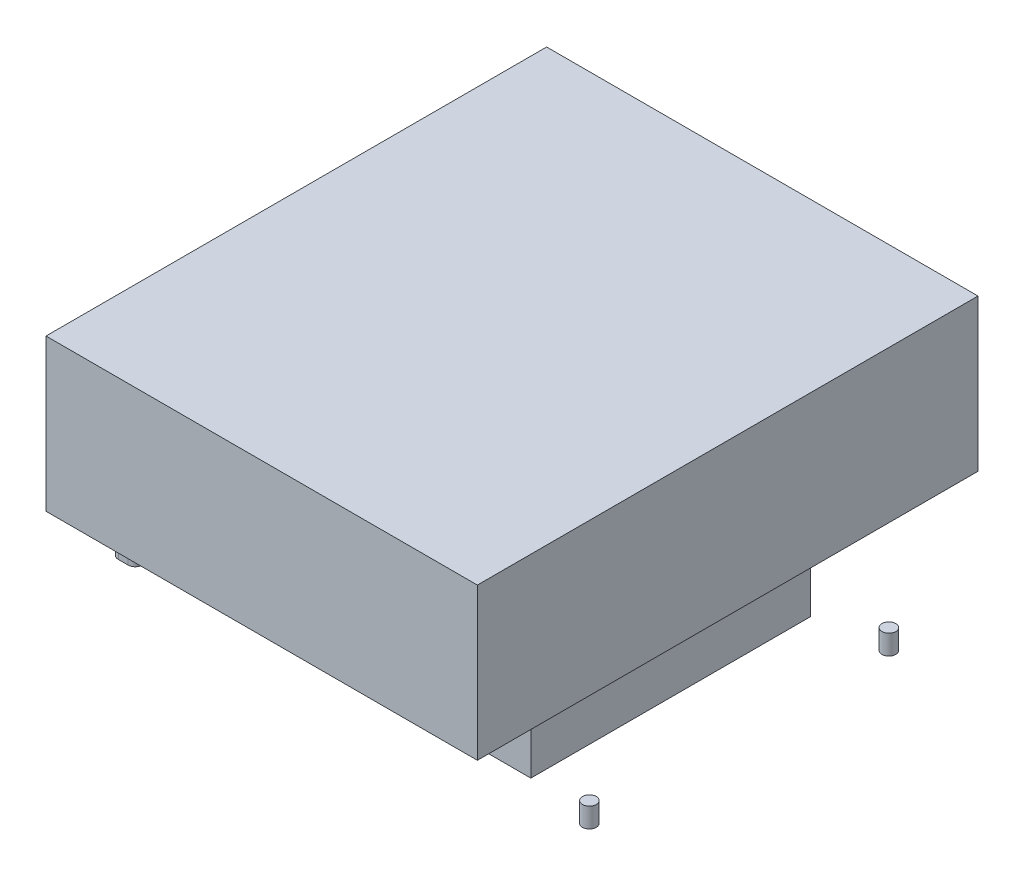
from build123d import *

# Parameters (mm, degrees)
SKETCH1_W             = 160
SKETCH1_H             = 141
BOSS_EXTRUDE1_DEPTH   = 50
BOSS_EXTRUDE2_START   = 50
SKETCH1_3_W           = 217.4875
SKETCH1_3_H           = 252.4125
BOSS_EXTRUDE2_DEPTH   = 76.5302
BOSS_EXTRUDE3_DEPTH   = 10
BOSS_EXTRUDE3_2_DEPTH = 10
SKETCH1_4_R           = 3.5
BOSS_EXTRUDE3_3_DEPTH = 10
BOSS_EXTRUDE3_4_DEPTH = 10


with BuildPart() as part:
    # Sketch1 → Boss-Extrude1 (new body)
    with BuildSketch(Plane(origin=(0, 0, 0), x_dir=(1, 0, 0), z_dir=(0, 1, 0))):
        Rectangle(SKETCH1_W, SKETCH1_H)
    extrude(amount=BOSS_EXTRUDE1_DEPTH)

    # Sketch1<3> → Boss-Extrude2 (add)
    with BuildSketch(Plane(origin=(0, 0, 0), x_dir=(1, 0, 0), z_dir=(0, 1, 0)).offset(BOSS_EXTRUDE2_START)):
        Rectangle(SKETCH1_3_W, SKETCH1_3_H)
    extrude(amount=BOSS_EXTRUDE2_DEPTH)


with BuildPart() as body_2:
    # Sketch1<4> → Boss-Extrude3 (new body)
    with BuildSketch(Plane(origin=(0, 0, 0), x_dir=(1, 0, 0), z_dir=(0, 1, 0))):
        with BuildLine():
            ThreePointArc((-114.5, 79), (-111, 75.5), (-114.5, 72))
            Line((-114.5, 72), (-119.5, 72))
            ThreePointArc((-119.5, 72), (-122.999998138, 75.5), (-119.5, 79))
            Line((-119.5, 79), (-114.5, 79))
        make_face()
    extrude(amount=BOSS_EXTRUDE3_DEPTH)


with BuildPart() as body_3:
    # Sketch1<4> → Boss-Extrude3 2 (new body)
    with BuildSketch(Plane(origin=(0, 0, 0), x_dir=(1, 0, 0), z_dir=(0, 1, 0))):
        with BuildLine():
            ThreePointArc((-114.499999164, -72), (-110.999999164, -75.5), (-114.499999164, -79))
            Line((-114.499999164, -79), (-119.499999164, -79))
            ThreePointArc((-119.499999164, -79), (-122.999998974, -75.5), (-119.499999164, -72))
            Line((-119.499999164, -72), (-114.499999164, -72))
        make_face()
    extrude(amount=BOSS_EXTRUDE3_2_DEPTH)


with BuildPart() as body_4:
    # Sketch1<4> → Boss-Extrude3 3 (new body)
    with BuildSketch(Plane(origin=(0, 0, 0), x_dir=(1, 0, 0), z_dir=(0, 1, 0))):
        with Locations(Location((114.5, -75.5, 0), (0, 0, 270))):
            Circle(SKETCH1_4_R)
    extrude(amount=BOSS_EXTRUDE3_3_DEPTH)


with BuildPart() as body_5:
    # Sketch1<4> → Boss-Extrude3 4 (new body)
    with BuildSketch(Plane(origin=(0, 0, 0), x_dir=(1, 0, 0), z_dir=(0, 1, 0))):
        with Locations(Location((114.5, 75.5, 0), (0, 0, 270))):
            Circle(SKETCH1_4_R)
    extrude(amount=BOSS_EXTRUDE3_4_DEPTH)


solid = Compound([part.part, body_2.part, body_3.part, body_4.part, body_5.part])
